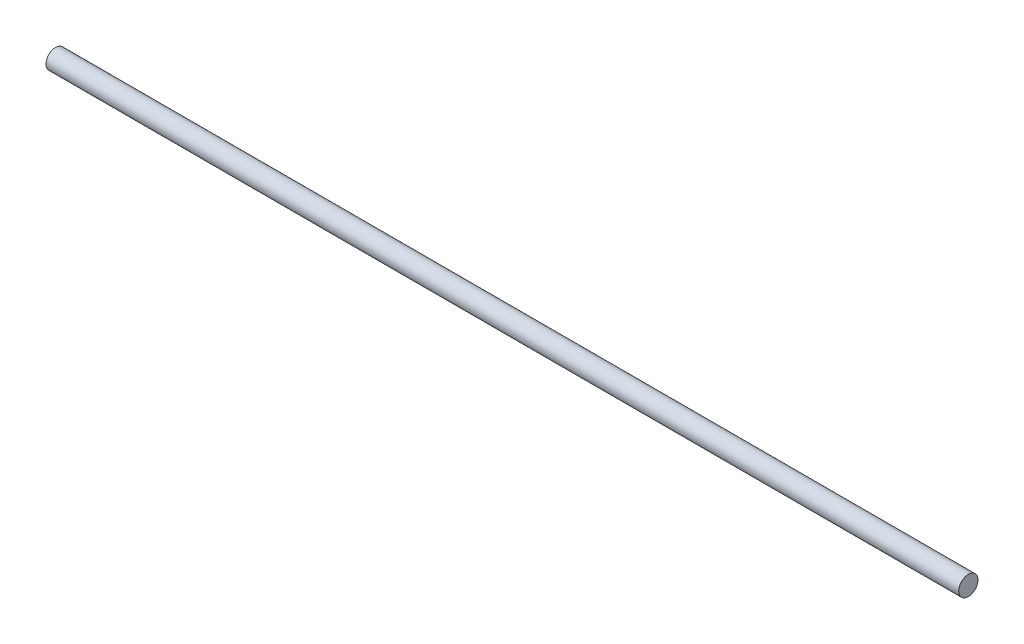
from build123d import *

# Parameters (mm, degrees)
SKETCH1_R           = 6.35
BOSS_EXTRUDE1_DEPTH = 300


with BuildPart() as part:
    # Sketch1 → Boss-Extrude1 (new, symmetric)
    with BuildSketch(Plane(origin=(0, 0, 0), x_dir=(0, 0, -1), z_dir=(1, 0, 0))):
        Circle(SKETCH1_R)
    extrude(amount=BOSS_EXTRUDE1_DEPTH, both=True)


solid = part.part
